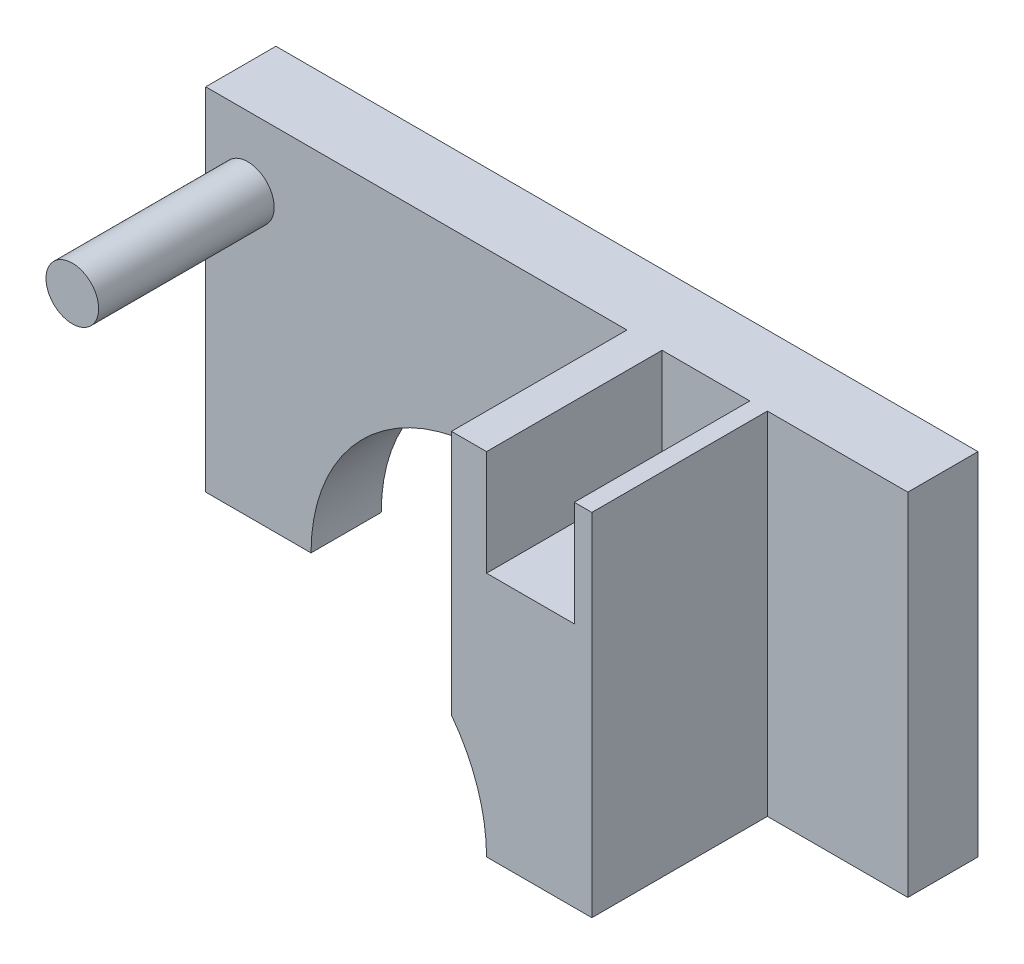
from build123d import *

# Parameters (mm, degrees)
SKICA1_W                 = 200
SKICA1_H                 = 100
P_IDAT_VYSUNUT_M1_DEPTH  = 20
P_IDAT_VYSUNUT_M2_DEPTH  = 50
ODEBRAT_VYSUNUT_M1_REACH = 236.307
SKICA4_R                 = 50
SKICA7_R                 = 7.5
P_IDAT_VYSUNUT_M3_DEPTH  = 50


with BuildPart() as part:
    # Skica1 → Přidat vysunutím1 (new body)
    with BuildSketch(Plane.XY):
        with Locations((100, 50)):
            Rectangle(SKICA1_W, SKICA1_H)
    extrude(amount=P_IDAT_VYSUNUT_M1_DEPTH)

    # Skica2 → Přidat vysunutím2 (add)
    with BuildSketch(Plane.XY.offset(20)):
        Polygon((120, 0), (160, 0), (160, 100), (155, 100), (155, 70), (130, 70), (130, 100), (120, 100), align=None)
    extrude(amount=P_IDAT_VYSUNUT_M2_DEPTH)

    # Odebrat vysunutím1: up to this face of the body (flat: up to its plane)
    odebrat_vysunut_m1_end = Plane(part.part.faces().sort_by_distance((139.423076923, 41.923076923, 70))[0])
    # Skica4 → Odebrat vysunutím1 (cut, up to the picked face)
    with BuildSketch(Plane(origin=(0, 0, 0), x_dir=(-1, 0, 0), z_dir=(0, 0, -1)), mode=Mode.PRIVATE) as odebrat_vysunut_m1_sk1:
        with Locations((-80, 0)):
            Circle(SKICA4_R)
    odebrat_vysunut_m1_tool1 = split(extrude(odebrat_vysunut_m1_sk1.sketch, amount=-ODEBRAT_VYSUNUT_M1_REACH, mode=Mode.PRIVATE), bisect_by=odebrat_vysunut_m1_end, keep=Keep.BOTH, mode=Mode.PRIVATE)
    add(odebrat_vysunut_m1_tool1.solids().sort_by(Axis((80, 0, 0), (0, 0, 1)))[0], mode=Mode.SUBTRACT)

    # Skica7 → Přidat vysunutím3 (add)
    with BuildSketch(Plane.XY.offset(20)):
        with Locations(Location((12, 80, 0), (0, 0, 180))):
            Circle(SKICA7_R)
    extrude(amount=P_IDAT_VYSUNUT_M3_DEPTH)


solid = part.part
